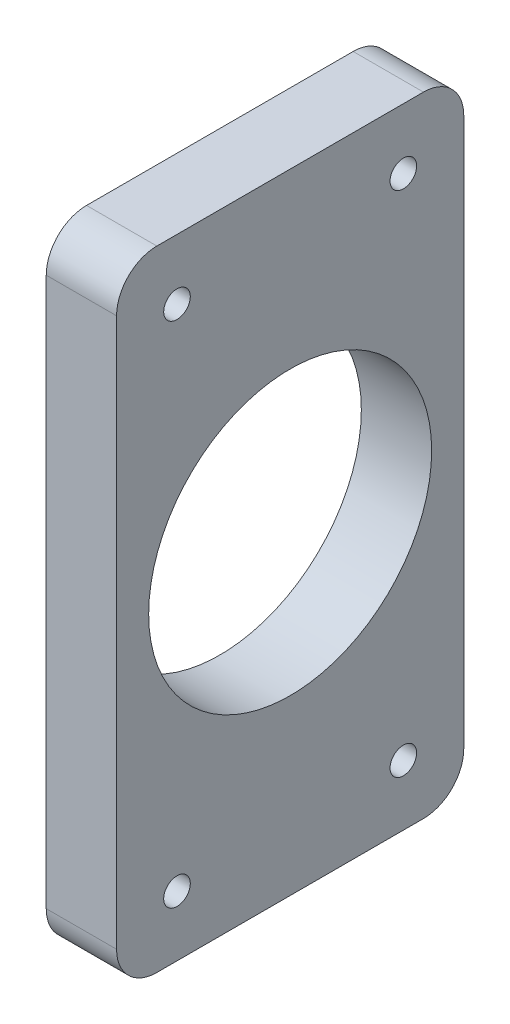
from build123d import *

# Parameters (mm, degrees)
SKETCH1_R                               = 2.25
SKETCH1_R_2                             = 17.5641
BOSS_EXTRUDE1_DEPTH                     = 4.365625
SKETCH2_W                               = 78.1
SKETCH2_H                               = 43.1
BOSS_EXTRUDE2_DEPTH                     = 8.73125
M4_CLEARANCE_HOLE2_AT_2_COUNT           = 2
M4_CLEARANCE_HOLE2_AT_2_PITCH           = 28.1
M4_CLEARANCE_HOLE2_AT_3_COUNT           = 2
M4_CLEARANCE_HOLE2_AT_3_PITCH           = 69.07401827
M4_CLEARANCE_HOLE2_AT_4_COUNT           = 2
M4_CLEARANCE_HOLE2_AT_4_PITCH           = 63.1
SKETCH24_W                              = 78.1
SKETCH24_H                              = 43.1
BOSS_EXTRUDE3_DEPTH                     = 8.73125
TAP_DRILL_FOR_M4X0_7_TAP1_AT_2_COUNT    = 2
TAP_DRILL_FOR_M4X0_7_TAP1_AT_2_PITCH    = 28.1
TAP_DRILL_FOR_M4X0_7_TAP1_AT_3_COUNT    = 2
TAP_DRILL_FOR_M4X0_7_TAP1_AT_3_PITCH    = 69.07401827
TAP_DRILL_FOR_M4X0_7_TAP1_AT_4_COUNT    = 2
TAP_DRILL_FOR_M4X0_7_TAP1_AT_4_PITCH    = 63.1
TAP_DRILL_FOR_M3X0_5_TAP1_AT_2_COUNT    = 2
TAP_DRILL_FOR_M3X0_5_TAP1_AT_2_PITCH    = 36
TAP_DRILL_FOR_M3X0_5_TAP1_AT_3_COUNT    = 2
TAP_DRILL_FOR_M3X0_5_TAP1_AT_3_PITCH    = 28
TAP_DRILL_FOR_M3X0_5_TAP1_AT_4_COUNT    = 2
TAP_DRILL_FOR_M3X0_5_TAP1_AT_4_PITCH    = 45.607017004
TAP_DRILL_FOR_M2_5X0_45_TAP2_AT_2_COUNT = 2
TAP_DRILL_FOR_M2_5X0_45_TAP2_AT_2_PITCH = 15.8
SKETCH3_R                               = 17.5641
CUT_EXTRUDE3_DEPTH                      = 181.027817403
M6_CLEARANCE_HOLE2_AT_2_COUNT           = 2
M6_CLEARANCE_HOLE2_AT_2_PITCH           = 80
SKETCH14_W                              = 86.5
SKETCH14_H                              = 58.5
CUT_EXTRUDE4_DEPTH                      = 2
FILLET4_R                               = 10
M4_CLEARANCE_HOLE1_AT_2_COUNT           = 2
M4_CLEARANCE_HOLE1_AT_2_PITCH           = 14.136551913
M4_CLEARANCE_HOLE1_AT_3_COUNT           = 2
M4_CLEARANCE_HOLE1_AT_3_PITCH           = 7.068275957
M6_CLEARANCE_HOLE1_AT_2_COUNT           = 2
M6_CLEARANCE_HOLE1_AT_2_PITCH           = 25.4
FILLET5_R                               = 5
FILLET6_R                               = 5
SKETCH28_W                              = 15.5
SKETCH28_H                              = 20.75
SKETCH28_R                              = 1.5
BOSS_EXTRUDE4_DEPTH                     = 2.5
FILLET7_R                               = 1
SKETCH29_R                              = 1.5
BOSS_EXTRUDE5_DEPTH                     = 1.5
FILLET8_R                               = 0.5


with BuildPart() as part:
    # Sketch1 → Boss-Extrude1 (new, symmetric)
    with BuildSketch(Plane.YZ):
        Polygon((0, 170.95), (-50, 110.95), (-50, -79.05), (50, -79.05), (50, 110.95), align=None)
        with Locations((-26.25, -56.8)):
            Circle(SKETCH1_R, mode=Mode.SUBTRACT)
        with Locations((-26.25, -32.3)):
            Circle(SKETCH1_R, mode=Mode.SUBTRACT)
        with Locations((26.25, -56.8)):
            Circle(SKETCH1_R, mode=Mode.SUBTRACT)
        with Locations((26.25, -32.3)):
            Circle(SKETCH1_R, mode=Mode.SUBTRACT)
        Circle(SKETCH1_R_2, mode=Mode.SUBTRACT)
    extrude(amount=BOSS_EXTRUDE1_DEPTH, both=True)


with BuildPart() as body_2:
    # Sketch2 → Boss-Extrude2 (new body)
    with BuildSketch(Plane.YZ.offset(4.365625)):
        Rectangle(SKETCH2_W, SKETCH2_H)
    extrude(amount=BOSS_EXTRUDE2_DEPTH)


with BuildPart() as m4_clearance_hole2_tool:
    # Sketch23 → M4 Clearance Hole2 (revolve)
    with BuildSketch(Plane(origin=(13.096875, -31.55, 14.05), x_dir=(0, 0, -1), z_dir=(0, 1, 0))):
        Polygon((0, 0), (0, 17.4625), (2.25, 17.4625), (2.25, 0.025), (2.275, 0), align=None)
    m4_clearance_hole2 = revolve(axis=Axis((19.446875, -31.55, 14.05), (-1, 0, 0)))


with BuildPart() as part_1:
    add(part.part)

    # M4 Clearance Hole2: cut by m4_clearance_hole2_tool
    add(m4_clearance_hole2_tool.part, mode=Mode.SUBTRACT)


with BuildPart() as body_2_1:
    add(body_2.part)

    # M4 Clearance Hole2: cut by m4_clearance_hole2_tool
    add(m4_clearance_hole2_tool.part, mode=Mode.SUBTRACT)


with BuildPart() as m4_clearance_hole2_at_2_tool:
    # M4 Clearance Hole2 at 2: M4 Clearance Hole2 ×2
    with Locations(*[(0, 0, -i * M4_CLEARANCE_HOLE2_AT_2_PITCH) for i in range(1, M4_CLEARANCE_HOLE2_AT_2_COUNT)]):
        add(m4_clearance_hole2)


with BuildPart() as part_2:
    add(part_1.part)

    # M4 Clearance Hole2 at 2: cut by m4_clearance_hole2_at_2_tool
    add(m4_clearance_hole2_at_2_tool.part, mode=Mode.SUBTRACT)


with BuildPart() as body_2_2:
    add(body_2_1.part)

    # M4 Clearance Hole2 at 2: cut by m4_clearance_hole2_at_2_tool
    add(m4_clearance_hole2_at_2_tool.part, mode=Mode.SUBTRACT)


with BuildPart() as m4_clearance_hole2_at_3_tool:
    # M4 Clearance Hole2 at 3: M4 Clearance Hole2 ×2
    with Locations(*[Vector(0, 0.9135128023552276, -0.40680998012966574) * (i * M4_CLEARANCE_HOLE2_AT_3_PITCH) for i in range(1, M4_CLEARANCE_HOLE2_AT_3_COUNT)]):
        add(m4_clearance_hole2)


with BuildPart() as part_3:
    add(part_2.part)

    # M4 Clearance Hole2 at 3: cut by m4_clearance_hole2_at_3_tool
    add(m4_clearance_hole2_at_3_tool.part, mode=Mode.SUBTRACT)


with BuildPart() as body_2_3:
    add(body_2_2.part)

    # M4 Clearance Hole2 at 3: cut by m4_clearance_hole2_at_3_tool
    add(m4_clearance_hole2_at_3_tool.part, mode=Mode.SUBTRACT)


with BuildPart() as m4_clearance_hole2_at_4_tool:
    # M4 Clearance Hole2 at 4: M4 Clearance Hole2 ×2
    with Locations(*[(0, i * M4_CLEARANCE_HOLE2_AT_4_PITCH, 0) for i in range(1, M4_CLEARANCE_HOLE2_AT_4_COUNT)]):
        add(m4_clearance_hole2)


with BuildPart() as part_4:
    add(part_3.part)

    # M4 Clearance Hole2 at 4: cut by m4_clearance_hole2_at_4_tool
    add(m4_clearance_hole2_at_4_tool.part, mode=Mode.SUBTRACT)

    # Sketch7 → Tap Drill for M3x0.5 Tap1 (revolve, cut)
    with BuildSketch(Plane(origin=(4.365625, -18, -24.05), x_dir=(0, 0, -1), z_dir=(0, 1, 0))):
        Polygon((0, 0), (0, 17.4625), (1.25, 17.4625), (1.25, 0.025), (1.275, 0), align=None)
    tap_drill_for_m3x0_5_tap1 = revolve(axis=Axis((10.715625, -18, -24.05), (-1, 0, 0)), mode=Mode.SUBTRACT)

    # Tap Drill for M3x0.5 Tap1 at 2: Tap Drill for M3x0.5 Tap1 ×2
    with Locations(*[(0, i * TAP_DRILL_FOR_M3X0_5_TAP1_AT_2_PITCH, 0) for i in range(1, TAP_DRILL_FOR_M3X0_5_TAP1_AT_2_COUNT)]):
        add(tap_drill_for_m3x0_5_tap1, mode=Mode.SUBTRACT)

    # Tap Drill for M3x0.5 Tap1 at 3: Tap Drill for M3x0.5 Tap1 ×2
    with Locations(*[(0, 0, -i * TAP_DRILL_FOR_M3X0_5_TAP1_AT_3_PITCH) for i in range(1, TAP_DRILL_FOR_M3X0_5_TAP1_AT_3_COUNT)]):
        add(tap_drill_for_m3x0_5_tap1, mode=Mode.SUBTRACT)

    # Tap Drill for M3x0.5 Tap1 at 4: Tap Drill for M3x0.5 Tap1 ×2
    with Locations(*[Vector(0, 0.7893522173763264, -0.6139406135149205) * (i * TAP_DRILL_FOR_M3X0_5_TAP1_AT_4_PITCH) for i in range(1, TAP_DRILL_FOR_M3X0_5_TAP1_AT_4_COUNT)]):
        add(tap_drill_for_m3x0_5_tap1, mode=Mode.SUBTRACT)

    # Sketch10 → Tap Drill for M2.5x0.45 Tap2 (revolve, cut)
    with BuildSketch(Plane(origin=(4.365625, -41, 103.325), x_dir=(0, 0, -1), z_dir=(0, 1, 0))):
        Polygon((0, 0), (0, 17.4625), (1.025, 17.4625), (1.025, 0.025), (1.05, 0), align=None)
    tap_drill_for_m2_5x0_45_tap2 = revolve(axis=Axis((10.715625, -41, 103.325), (-1, 0, 0)), mode=Mode.SUBTRACT)

    # Tap Drill for M2.5x0.45 Tap2 at 2: Tap Drill for M2.5x0.45 Tap2 ×2
    with Locations(*[(0, 0, -i * TAP_DRILL_FOR_M2_5X0_45_TAP2_AT_2_PITCH) for i in range(1, TAP_DRILL_FOR_M2_5X0_45_TAP2_AT_2_COUNT)]):
        add(tap_drill_for_m2_5x0_45_tap2, mode=Mode.SUBTRACT)

    # Sketch12 → M6 Clearance Hole2 (revolve, cut)
    with BuildSketch(Plane(origin=(4.365625, -40, -69.05), x_dir=(0, 0, -1), z_dir=(0, 1, 0))):
        Polygon((0, 0), (0, 17.4625), (3.3, 17.4625), (3.3, 0.025), (3.325, 0), align=None)
    m6_clearance_hole2 = revolve(axis=Axis((10.715625, -40, -69.05), (-1, 0, 0)), mode=Mode.SUBTRACT)

    # M6 Clearance Hole2 at 2: M6 Clearance Hole2 ×2
    with Locations(*[(0, i * M6_CLEARANCE_HOLE2_AT_2_PITCH, 0) for i in range(1, M6_CLEARANCE_HOLE2_AT_2_COUNT)]):
        add(m6_clearance_hole2, mode=Mode.SUBTRACT)

    # Sketch14 → Cut-Extrude4 (cut)
    with BuildSketch(Plane.YZ.offset(4.365625)):
        with Locations((0, 50.8)):
            Rectangle(SKETCH14_W, SKETCH14_H)
    extrude(amount=-CUT_EXTRUDE4_DEPTH, mode=Mode.SUBTRACT)

    # Fillet4
    fillet4_edges = [part_4.edges().sort_by_distance(p)[0] for p in [
        (0, 50, -79.05),
        (0, -50, -79.05),
        (0, 50, 110.95),
        (0, 0, 170.95),
        (0, -50, 110.95),
    ]]
    fillet(fillet4_edges, radius=FILLET4_R)

    # Sketch16 → M4 Clearance Hole1 (revolve, cut)
    with BuildSketch(Plane(origin=(4.365625, 0, 155.329500648), x_dir=(0, 0, -1), z_dir=(0, 1, 0))):
        Polygon((0, 0), (0, 17.4625), (2.25, 17.4625), (2.25, 0.025), (2.275, 0), align=None)
    m4_clearance_hole1 = revolve(axis=Axis((10.715625, 0, 155.329500648), (-1, 0, 0)), mode=Mode.SUBTRACT)

    # M4 Clearance Hole1 at 2: M4 Clearance Hole1 ×2
    with Locations(*[(0, 0, -i * M4_CLEARANCE_HOLE1_AT_2_PITCH) for i in range(1, M4_CLEARANCE_HOLE1_AT_2_COUNT)]):
        add(m4_clearance_hole1, mode=Mode.SUBTRACT)

    # M4 Clearance Hole1 at 3: M4 Clearance Hole1 ×2
    with Locations(*[(0, 0, -i * M4_CLEARANCE_HOLE1_AT_3_PITCH) for i in range(1, M4_CLEARANCE_HOLE1_AT_3_COUNT)]):
        add(m4_clearance_hole1, mode=Mode.SUBTRACT)

    # Sketch21 → M6 Clearance Hole1 (revolve, cut)
    with BuildSketch(Plane(origin=(4.365625, 0, 131.273931646), x_dir=(0, 0, -1), z_dir=(0, 1, 0))):
        Polygon((0, 0), (0, 17.4625), (3.3, 17.4625), (3.3, 0.025), (3.325, 0), align=None)
    m6_clearance_hole1 = revolve(axis=Axis((10.715625, 0, 131.273931646), (-1, 0, 0)), mode=Mode.SUBTRACT)

    # M6 Clearance Hole1 at 2: M6 Clearance Hole1 ×2
    with Locations(*[(0, 0, -i * M6_CLEARANCE_HOLE1_AT_2_PITCH) for i in range(1, M6_CLEARANCE_HOLE1_AT_2_COUNT)]):
        add(m6_clearance_hole1, mode=Mode.SUBTRACT)


with BuildPart() as body_2_4:
    add(body_2_3.part)

    # M4 Clearance Hole2 at 4: cut by m4_clearance_hole2_at_4_tool
    add(m4_clearance_hole2_at_4_tool.part, mode=Mode.SUBTRACT)


with BuildPart() as body_3:
    # Sketch24 → Boss-Extrude3 (new body)
    with BuildSketch(Plane(origin=(-4.365625, 0, 0), x_dir=(0, -1, 0), z_dir=(-1, 0, 0))):
        Rectangle(SKETCH24_W, SKETCH24_H)
    extrude(amount=BOSS_EXTRUDE3_DEPTH)

    # Sketch27 → Tap Drill for M4x0.7 Tap1 (revolve, cut)
    with BuildSketch(Plane(origin=(-13.096875, 31.55, 14.05), x_dir=(0, 0, 1), z_dir=(0, 1, 0))):
        Polygon((0, 0), (0, 9.722670021), (1.65, 8.73125), (1.65, 0.025), (1.675, 0), align=None)
    tap_drill_for_m4x0_7_tap1 = revolve(axis=Axis((-19.446875, 31.55, 14.05), (1, 0, 0)), mode=Mode.SUBTRACT)

    # Tap Drill for M4x0.7 Tap1 at 2: Tap Drill for M4x0.7 Tap1 ×2
    with Locations(*[(0, 0, -i * TAP_DRILL_FOR_M4X0_7_TAP1_AT_2_PITCH) for i in range(1, TAP_DRILL_FOR_M4X0_7_TAP1_AT_2_COUNT)]):
        add(tap_drill_for_m4x0_7_tap1, mode=Mode.SUBTRACT)

    # Tap Drill for M4x0.7 Tap1 at 3: Tap Drill for M4x0.7 Tap1 ×2
    with Locations(*[Vector(0, -0.9135128023552276, -0.40680998012966574) * (i * TAP_DRILL_FOR_M4X0_7_TAP1_AT_3_PITCH) for i in range(1, TAP_DRILL_FOR_M4X0_7_TAP1_AT_3_COUNT)]):
        add(tap_drill_for_m4x0_7_tap1, mode=Mode.SUBTRACT)

    # Tap Drill for M4x0.7 Tap1 at 4: Tap Drill for M4x0.7 Tap1 ×2
    with Locations(*[(0, -i * TAP_DRILL_FOR_M4X0_7_TAP1_AT_4_PITCH, 0) for i in range(1, TAP_DRILL_FOR_M4X0_7_TAP1_AT_4_COUNT)]):
        add(tap_drill_for_m4x0_7_tap1, mode=Mode.SUBTRACT)


with BuildPart() as cut_extrude3_tool:
    # Sketch3 → Cut-Extrude3 (new, through all)
    with BuildSketch(Plane.YZ.offset(13.096875)):
        Circle(SKETCH3_R)
    extrude(amount=-CUT_EXTRUDE3_DEPTH)


with BuildPart() as body_2_5:
    add(body_2_4.part)

    # Cut-Extrude3: cut by cut_extrude3_tool
    add(cut_extrude3_tool.part, mode=Mode.SUBTRACT)

    # Fillet6
    fillet6_edges = [body_2_5.edges().sort_by_distance(p)[0] for p in [
        (8.73125, -39.05, 21.55),
        (8.73125, 39.05, -21.55),
        (8.73125, -39.05, -21.55),
        (8.73125, 39.05, 21.55),
    ]]
    fillet(fillet6_edges, radius=FILLET6_R)


with BuildPart() as body_3_1:
    add(body_3.part)

    # Cut-Extrude3: cut by cut_extrude3_tool
    add(cut_extrude3_tool.part, mode=Mode.SUBTRACT)

    # Fillet5
    fillet5_edges = [body_3_1.edges().sort_by_distance(p)[0] for p in [
        (-8.73125, -39.05, 21.55),
        (-8.73125, -39.05, -21.55),
        (-8.73125, 39.05, -21.55),
        (-8.73125, 39.05, 21.55),
    ]]
    fillet(fillet5_edges, radius=FILLET5_R)


with BuildPart() as body_4:
    # Sketch28 → Boss-Extrude4 (new body)
    with BuildSketch(Plane.YZ.offset(4.365625)):
        with Locations((-46.275, 95.425)):
            Rectangle(SKETCH28_W, SKETCH28_H)
        with Locations((-41, 87.525)):
            Circle(SKETCH28_R, mode=Mode.SUBTRACT)
        with Locations((-41, 103.325)):
            Circle(SKETCH28_R, mode=Mode.SUBTRACT)
    extrude(amount=BOSS_EXTRUDE4_DEPTH)

    # Fillet7
    fillet7_edges = [body_4.edges().sort_by_distance(p)[0] for p in [
        (5.615625, -38.525, 105.8),
        (5.615625, -38.525, 85.05),
        (5.615625, -54.025, 85.05),
        (5.615625, -54.025, 105.8),
    ]]
    fillet(fillet7_edges, radius=FILLET7_R)

    # Sketch29 → Boss-Extrude5 (add)
    with BuildSketch(Plane(origin=(4.365625, 0, 0), x_dir=(0, -1, 0), z_dir=(-1, 0, 0))):
        with Locations((52.025, 104.175)):
            Circle(SKETCH29_R)
        with Locations((52.025, 100.675)):
            Circle(SKETCH29_R)
        with Locations((52.025, 97.175)):
            Circle(SKETCH29_R)
        with Locations((52.025, 93.675)):
            Circle(SKETCH29_R)
        with Locations((52.025, 90.175)):
            Circle(SKETCH29_R)
        with Locations((52.025, 86.675)):
            Circle(SKETCH29_R)
    extrude(amount=BOSS_EXTRUDE5_DEPTH)

    # Fillet8
    fillet8_edges = [body_4.edges().sort_by_distance(p)[0] for p in [
        (2.865625, -50.525, 86.675),
        (2.865625, -50.525, 90.175),
        (2.865625, -50.525, 93.675),
        (2.865625, -50.525, 97.175),
        (2.865625, -50.525, 100.675),
        (2.865625, -50.525, 104.175),
    ]]
    fillet(fillet8_edges, radius=FILLET8_R)


solid = body_3_1.part
